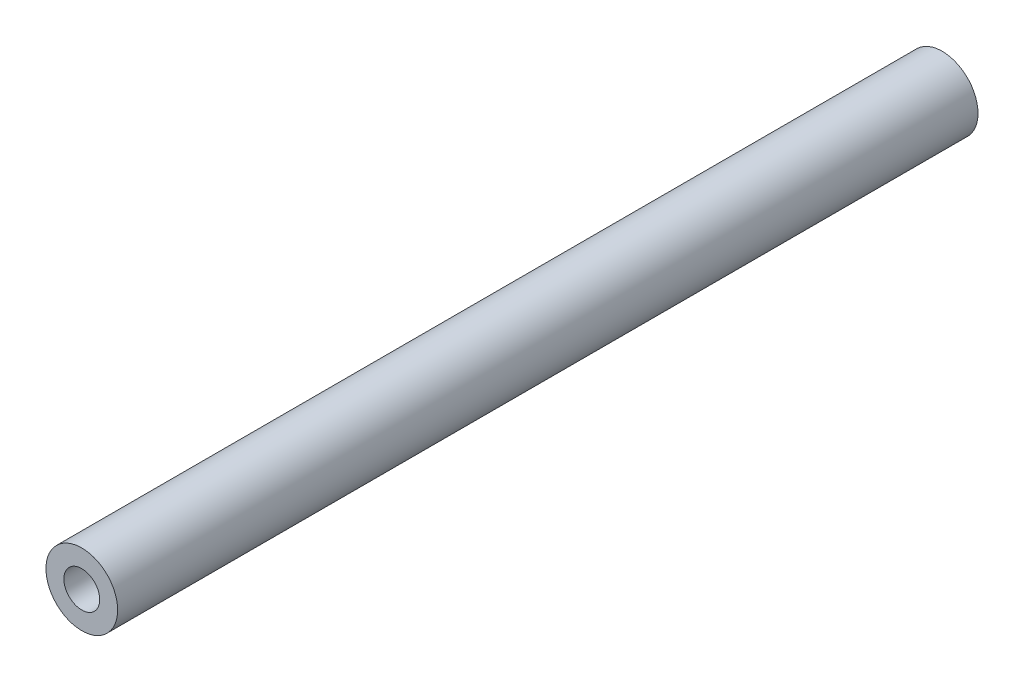
from build123d import *

# Parameters (mm, degrees)
SKETCH1_R           = 10
BOSS_EXTRUDE1_DEPTH = 100
BOSS_EXTRUDE2_START = 20
SKETCH3_R           = 10
SKETCH3_R_2         = 5
BOSS_EXTRUDE2_DEPTH = 20


with BuildPart() as part:
    # Sketch1 → Boss-Extrude1 (new, symmetric)
    with BuildSketch(Plane.XY):
        Circle(SKETCH1_R)
    extrude(amount=BOSS_EXTRUDE1_DEPTH, both=True)

    # Sketch3 → Boss-Extrude2 (add)
    with BuildSketch(Plane.XY.offset(100).offset(BOSS_EXTRUDE2_START)):
        Circle(SKETCH3_R)
        Circle(SKETCH3_R_2, mode=Mode.SUBTRACT)
    boss_extrude2 = extrude(amount=-BOSS_EXTRUDE2_DEPTH)

    # Mirror1: Boss-Extrude2 across plane
    add(boss_extrude2.mirror(Plane.XY))


solid = part.part
